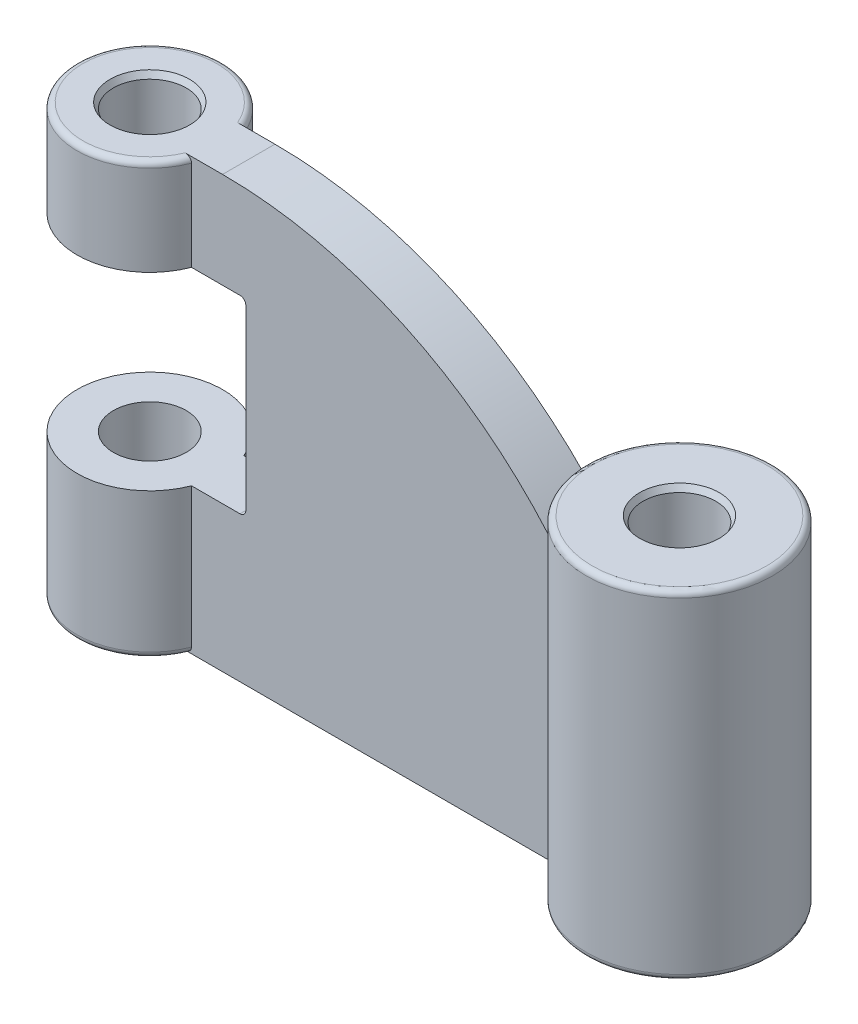
from build123d import *
from OCP.BRepFilletAPI import BRepFilletAPI_MakeChamfer

# Parameters (mm, degrees)
SKETCH1_W                = 19.5
SKETCH1_H                = 116
SKETCH3_W                = 12.5
SKETCH3_H                = 148
CHAMFER2_SIZE            = 2
CHAMFER2_SIZE2           = 1.154700538
FILLET1_R                = 2
FILLET2_R                = 2
FILLET3_R                = 2
BOSS_EXTRUDE1_DEPTH      = 9
BOSS_EXTRUDE1_DEPTH_BACK = 9
CHAMFER1_SIZE            = 2
CHAMFER1_SIZE2           = 1.154700538
CUT_EXTRUDE9_DEPTH       = 236.219047001
CUT_EXTRUDE9_DEPTH_BACK  = 236.219047001


with BuildPart() as part:
    # Sketch1 → Revolve2 (revolve)
    with BuildSketch(Plane.XY):
        with Locations((170.25, 58)):
            Rectangle(SKETCH1_W, SKETCH1_H)
    revolve(axis=Axis((148, 0, 0), (0, 1, 0)))

    # Chamfer2: one chamfer whose edges measure the first distance from different faces: ONE call of the kernel's chamfer builder (chamfer() names one face for all edges)
    chamfer2_edges_1 = [part.edges().sort_by_distance(p)[0] for p in [
        (135.5, 116, 0),
    ]]
    chamfer2_side_1 = [part.faces().sort_by_distance(p)[0] for p in [
        (135.5, 58, 0),
    ]]
    chamfer2_edges_2 = [part.edges().sort_by_distance(p)[0] for p in [
        (135.5, 0, 0),
    ]]
    chamfer2_side_2 = [part.faces().sort_by_distance(p)[0] for p in [
        (116.90509668, 0, 0),
    ]]
    chamfer2 = BRepFilletAPI_MakeChamfer(part.part.solid().wrapped)
    for e in chamfer2_edges_1:
        chamfer2.Add(CHAMFER2_SIZE, CHAMFER2_SIZE2, e.wrapped, chamfer2_side_1[0].wrapped)  # the first distance lies on this face
    for e in chamfer2_edges_2:
        chamfer2.Add(CHAMFER2_SIZE, CHAMFER2_SIZE2, e.wrapped, chamfer2_side_2[0].wrapped)  # the first distance lies on this face
    add(Compound.cast(chamfer2.Shape()), mode=Mode.REPLACE)

    # Fillet2
    fillet2_edges = [part.edges().sort_by_distance(p)[0] for p in [
        (116, 0, 0),
    ]]
    fillet(fillet2_edges, radius=FILLET2_R)

    # Fillet3
    fillet3_edges = [part.edges().sort_by_distance(p)[0] for p in [
        (116, 116, 0),
    ]]
    fillet(fillet3_edges, radius=FILLET3_R)



with BuildPart() as body_2:
    # Sketch3 → Revolve3 (revolve)
    with BuildSketch(Plane.XY):
        with Locations((-52.75, 74)):
            Rectangle(SKETCH3_W, SKETCH3_H)
    revolve(axis=Axis((-34, 0, 0), (0, 1, 0)))

    # Fillet1
    fillet1_edges = [body_2.edges().sort_by_distance(p)[0] for p in [
        (-9, 148, 0),
        (-9, 0, 0),
    ]]
    fillet(fillet1_edges, radius=FILLET1_R)


with BuildPart() as part_1:
    add(part.part)

    add(body_2.part)  # Boss-Extrude1 merges body 2
    # Sketch4 → Boss-Extrude1 (add, two sides: drawn at the far end of the back side and taken through both)
    with BuildSketch(Plane.XY.offset(-BOSS_EXTRUDE1_DEPTH_BACK)):
        with BuildLine():
            Line((0, 0), (-15.091814832, 0))
            Line((-15.091814832, 0), (-15.091814832, 148))
            Line((-15.091814832, 148), (0, 148))
            ThreePointArc((0, 148), (71.793516775, 129.420597082), (125.561619022, 78.347174987))
            Line((125.561619022, 78.347174987), (125.561619022, 0))
            Line((125.561619022, 0), (0, 0))
        make_face()
    extrude(amount=BOSS_EXTRUDE1_DEPTH + BOSS_EXTRUDE1_DEPTH_BACK)

    # Chamfer1: one chamfer whose edges measure the first distance from different faces: ONE call of the kernel's chamfer builder (chamfer() names one face for all edges)
    chamfer1_edges_1 = [part_1.edges().sort_by_distance(p)[0] for p in [
        (-21.5, 0, 0),
    ]]
    chamfer1_side_1 = [part_1.faces().sort_by_distance(p)[0] for p in [
        (71.485193213, 0, 0),
    ]]
    chamfer1_edges_2 = [part_1.edges().sort_by_distance(p)[0] for p in [
        (-21.5, 148, 0),
    ]]
    chamfer1_side_2 = [part_1.faces().sort_by_distance(p)[0] for p in [
        (-21.5, 74, 0),
    ]]
    chamfer1 = BRepFilletAPI_MakeChamfer(part_1.part.solid().wrapped)
    for e in chamfer1_edges_1:
        chamfer1.Add(CHAMFER1_SIZE, CHAMFER1_SIZE2, e.wrapped, chamfer1_side_1[0].wrapped)  # the first distance lies on this face
    for e in chamfer1_edges_2:
        chamfer1.Add(CHAMFER1_SIZE, CHAMFER1_SIZE2, e.wrapped, chamfer1_side_2[0].wrapped)  # the first distance lies on this face
    add(Compound.cast(chamfer1.Shape()), mode=Mode.REPLACE)

    # Sketch23 → Cut-Extrude9 (cut, two sides: drawn at the far end of the back side and taken through both)
    with BuildSketch(Plane.XY.offset(-CUT_EXTRUDE9_DEPTH_BACK)):
        with BuildLine():
            Line((-59, 50), (6, 50))
            ThreePointArc((6, 50), (7.414213562, 50.585786438), (8, 52))
            Line((8, 52), (8, 113))
            ThreePointArc((8, 113), (7.414213562, 114.414213562), (6, 115))
            Line((6, 115), (-59, 115))
            Line((-59, 115), (-59, 50))
        make_face()
    extrude(amount=CUT_EXTRUDE9_DEPTH + CUT_EXTRUDE9_DEPTH_BACK, mode=Mode.SUBTRACT)


solid = part_1.part
